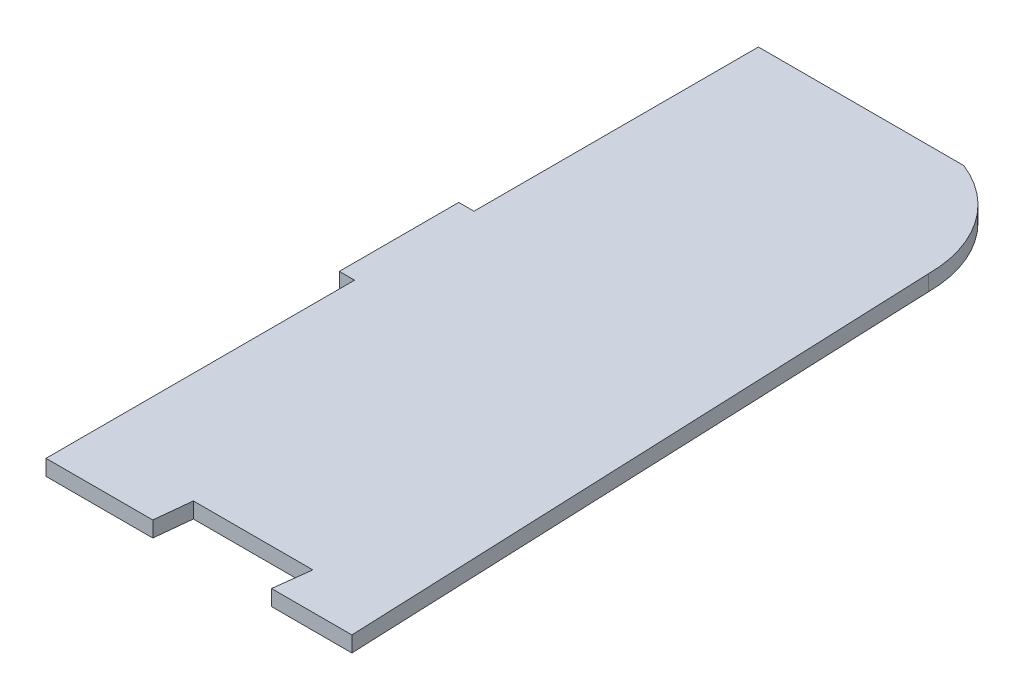
from build123d import *

# Parameters (mm, degrees)
BOSS_EXTRUDE1_DEPTH = 454.5100591
SKETCH3_W           = 117.668752198
SKETCH3_H           = 454.5100591
CUT_EXTRUDE1_DEPTH  = 10
SKETCH4_W           = 9.725175386
SKETCH4_H           = 196.85
SKETCH4_H_2         = 181.4600591
CUT_EXTRUDE3_DEPTH  = 63


with BuildPart() as part:
    # Sketch1 → Boss-Extrude1 (new body)
    with BuildSketch(Plane.XY):
        Polygon((358.121789204, 754.380000017), (137.961261276, 754.380000017), (137.961261276, 744.380000017), (562.803601281, 744.380000017), (562.803601281, 754.380000017), align=None)
    extrude(amount=BOSS_EXTRUDE1_DEPTH)

    # Sketch3 → Cut-Extrude1 (cut)
    with BuildSketch(Plane.XZ.offset(-744.380000017)):
        with Locations((196.795637375, 227.25502955)):
            Rectangle(SKETCH3_W, SKETCH3_H)
    extrude(amount=-CUT_EXTRUDE1_DEPTH, mode=Mode.SUBTRACT)

    # Sketch4 → Cut-Extrude3 (cut)
    with BuildSketch(Plane(origin=(0, 754.380000017, 0), x_dir=(1, 0, 0), z_dir=(0, 1, 0))):
        with Locations((260.492601167, -356.0850591)):
            Rectangle(SKETCH4_W, SKETCH4_H)
        with Locations((260.492601167, -90.73002955)):
            Rectangle(SKETCH4_W, SKETCH4_H_2)
        with BuildLine():
            Line((333.464234552, -454.5100591), (369.761877542, -561.839328351))
            Line((369.761877542, -561.839328351), (604.247212907, -525.668487146))
            Line((604.247212907, -525.668487146), (681.481358703, 161.10923172))
            Line((681.481358703, 161.10923172), (358.740146189, 101.846462791))
            Line((358.740146189, 101.846462791), (368.663785013, 5.2299409))
            ThreePointArc((368.663785013, 5.2299409), (422.54532174, -17.088522374), (444.863785013, -70.9700591))
            Line((444.863785013, -70.9700591), (460.501916297, -454.5100591))
            Line((460.501916297, -454.5100591), (409.216807378, -454.5100591))
            Line((409.216807378, -454.5100591), (412.127199539, -431.0400591))
            Line((412.127199539, -431.0400591), (335.927199539, -431.0400591))
            Line((335.927199539, -431.0400591), (333.464234552, -454.5100591))
        make_face()
    extrude(amount=-CUT_EXTRUDE3_DEPTH, mode=Mode.SUBTRACT)


solid = part.part
